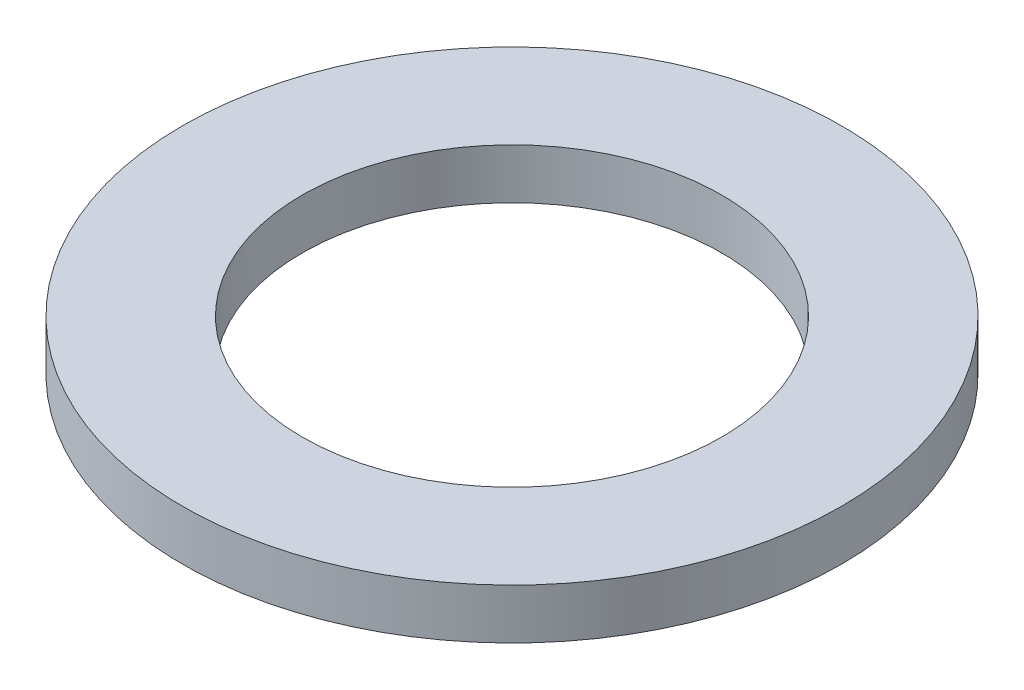
from build123d import *

# Parameters (mm, degrees)
SKETCH2_R           = 22
SKETCH2_R_2         = 14
EXTRUDE_THIN1_DEPTH = 3.35


with BuildPart() as part:
    # Sketch2 → Extrude-Thin1 (new body)
    with BuildSketch(Plane(origin=(0, 0, 0), x_dir=(1, 0, 0), z_dir=(0, 1, 0))):
        Circle(SKETCH2_R)
        Circle(SKETCH2_R_2, mode=Mode.SUBTRACT)
    extrude(amount=EXTRUDE_THIN1_DEPTH)


solid = part.part
